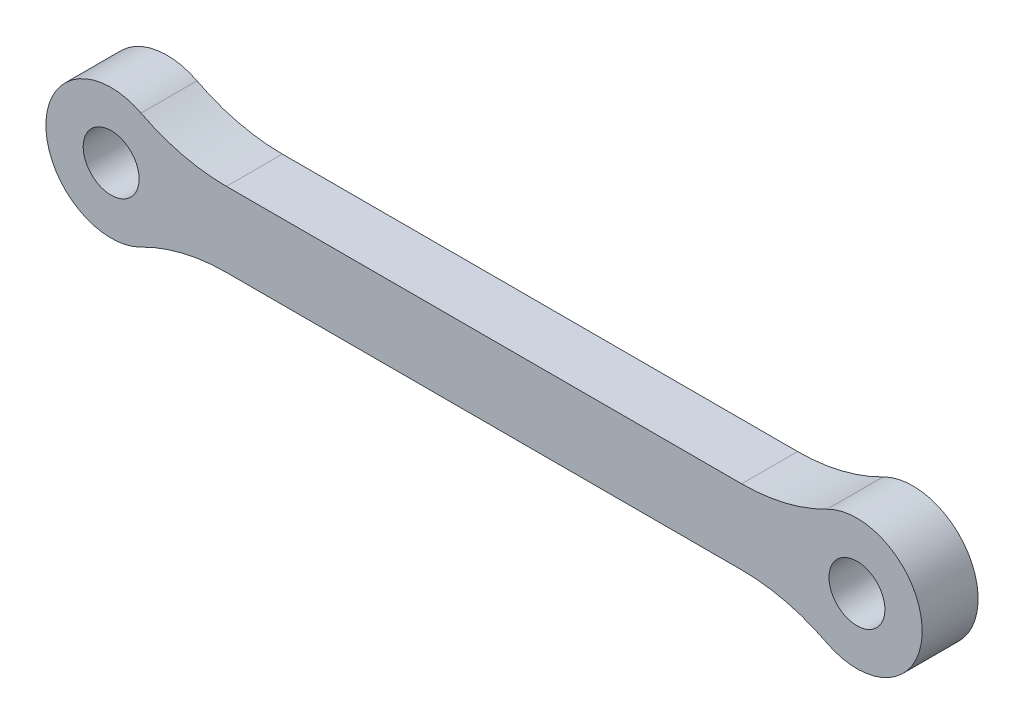
from build123d import *

# Parameters (mm, degrees)
SKETCH1_R           = 1.5
BOSS_EXTRUDE1_DEPTH = 3


with BuildPart() as part:
    # Sketch1 → Boss-Extrude1 (new body)
    with BuildSketch(Plane.XY):
        with BuildLine():
            Line((-33.815341562, 2), (-6.184658438, 2))
            ThreePointArc((-6.184658438, 2), (-3.827635834, 2.281746842), (-1.603429966, 3.111111111))
            ThreePointArc((-1.603429966, 3.111111111), (3.5, 0), (-1.603429966, -3.111111111))
            ThreePointArc((-1.603429966, -3.111111111), (-3.827635834, -2.281746842), (-6.184658438, -2))
            Line((-6.184658438, -2), (-33.815341562, -2))
            ThreePointArc((-33.815341562, -2), (-36.172364166, -2.281746842), (-38.396570034, -3.111111111))
            ThreePointArc((-38.396570034, -3.111111111), (-43.5, 0), (-38.396570034, 3.111111111))
            ThreePointArc((-38.396570034, 3.111111111), (-36.172364166, 2.281746842), (-33.815341562, 2))
        make_face()
        Circle(SKETCH1_R, mode=Mode.SUBTRACT)
        with Locations(Location((-40, 0, 0), (0, 0, 180))):
            Circle(SKETCH1_R, mode=Mode.SUBTRACT)
    extrude(amount=BOSS_EXTRUDE1_DEPTH)


solid = part.part
